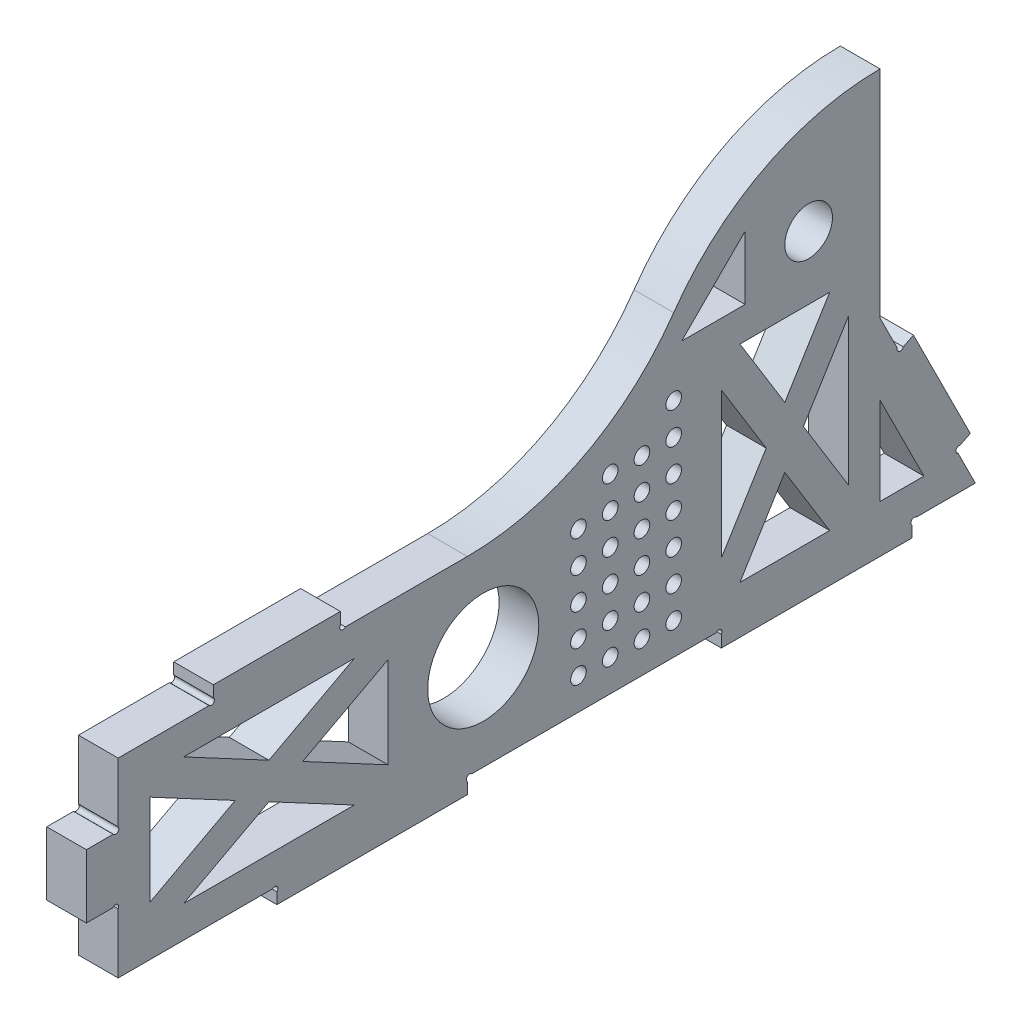
from build123d import *

# Parameters (mm, degrees)
BOSS_EXTRUDE1_DEPTH = 15.875
SKETCH2_R           = 9.525
CUT_EXTRUDE1_DEPTH  = 218.612378382
SKETCH3_W           = 76.2
SKETCH3_H           = 6.35
SKETCH3_W_2         = 12.7
SKETCH3_H_2         = 25.4
BOSS_EXTRUDE2_DEPTH = 15.875
SKETCH9_R           = 22.225
CUT_EXTRUDE4_DEPTH  = 218.612378382
CUT_EXTRUDE6_DEPTH  = 218.612378382
BOSS_EXTRUDE3_DEPTH = 15.875
SKETCH15_R          = 1.27
CUT_EXTRUDE8_DEPTH  = 218.612378382
SKETCH13_R          = 3.126994
CUT_EXTRUDE9_DEPTH  = 218.612378382
CUT_EXTRUDE10_DEPTH = 218.612378382


with BuildPart() as part:
    # Sketch1 → Boss-Extrude1 (new body)
    with BuildSketch(Plane(origin=(0, 0, 0), x_dir=(0, 0, -1), z_dir=(1, 0, 0))):
        with BuildLine():
            ThreePointArc((57.15, 81.28), (21.180615335, 49.546911859), (-25.4, 38.1))
            Line((-25.4, 38.1), (-76.2, 38.1))
            Line((-76.2, 38.1), (-76.2, 44.45))
            Line((-76.2, 44.45), (-127, 44.45))
            Line((-127, 44.45), (-127, 38.1))
            Line((-127, 38.1), (-165.1, 38.1))
            Line((-165.1, 38.1), (-165.1, -38.1))
            Line((-165.1, -38.1), (177.8, -38.1))
            Line((177.8, -38.1), (139.7, 38.1))
            Line((139.7, 38.1), (139.7, 124.46))
            ThreePointArc((139.7, 124.46), (93.119384665, 113.013088141), (57.15, 81.28))
        make_face()
    extrude(amount=BOSS_EXTRUDE1_DEPTH)

    # Sketch2 → Cut-Extrude1 (cut, through all)
    with BuildSketch(Plane(origin=(15.875, 0, 0), x_dir=(0, 0, -1), z_dir=(1, 0, 0))):
        with Locations((111.125, 82.55)):
            Circle(SKETCH2_R)
    extrude(amount=-CUT_EXTRUDE1_DEPTH, mode=Mode.SUBTRACT)

    # Sketch3 → Boss-Extrude2 (add)
    with BuildSketch(Plane(origin=(15.875, 0, 0), x_dir=(0, 0, -1), z_dir=(1, 0, 0))):
        with Locations((114.3, -41.275)):
            Rectangle(SKETCH3_W, SKETCH3_H)
        with Locations((-63.5, -41.275)):
            Rectangle(SKETCH3_W, SKETCH3_H)
        with Locations((-171.45, 0)):
            Rectangle(SKETCH3_W_2, SKETCH3_H_2)
    extrude(amount=-BOSS_EXTRUDE2_DEPTH)

    # Sketch9 → Cut-Extrude4 (cut, through all)
    with BuildSketch(Plane(origin=(15.875, 0, 0), x_dir=(0, 0, -1), z_dir=(1, 0, 0))):
        with Locations((-19.05, 0)):
            Circle(SKETCH9_R)
    extrude(amount=-CUT_EXTRUDE4_DEPTH, mode=Mode.SUBTRACT)

    # Sketch12 → Cut-Extrude6 (cut, through all)
    with BuildSketch(Plane(origin=(15.875, 0, 0), x_dir=(0, 0, -1), z_dir=(1, 0, 0))):
        Polygon((139.7, 9.701936686), (139.7, -25.4), (157.250968343, -25.4), align=None)
        Polygon((109.05604179, 15.875), (127, -13.283932092), (127, 45.033932092), align=None)
        Polygon((119.54395821, -25.4), (101.6, 3.758932092), (83.65604179, -25.4), align=None)
        Polygon((76.2, -13.283932092), (94.14395821, 15.875), (76.2, 45.033932092), align=None)
        Polygon((83.65604179, 57.15), (101.6, 27.991067908), (119.54395821, 57.15), align=None)
        Polygon((-57.15, -18.203333333), (-57.15, 18.203333333), (-91.28125, 0), align=None)
        Polygon((-70.64375, -25.4), (-104.775, -7.196666667), (-138.90625, -25.4), align=None)
        Polygon((-152.4, -18.203333333), (-118.26875, 0), (-152.4, 18.203333333), align=None)
        Polygon((-104.775, 7.196666667), (-70.64375, 25.4), (-138.90625, 25.4), align=None)
    extrude(amount=-CUT_EXTRUDE6_DEPTH, mode=Mode.SUBTRACT)

    # Sketch14 → Boss-Extrude3 (add)
    with BuildSketch(Plane(origin=(15.875, 0, 0), x_dir=(0, 0, -1), z_dir=(1, 0, 0))):
        Polygon((147.390774674, 22.718450651), (170.109225326, -22.718450651), (175.788837989, -19.87864432), (153.070387337, 25.558256983), align=None)
    extrude(amount=-BOSS_EXTRUDE3_DEPTH)

    # Sketch15 → Cut-Extrude8 (cut, through all)
    with BuildSketch(Plane(origin=(15.875, 0, 0), x_dir=(0, 0, -1), z_dir=(1, 0, 0))):
        with Locations((-166.14759319, -13.417947427)):
            Circle(SKETCH15_R)
        with Locations((-127.867535363, 39.027514093)):
            Circle(SKETCH15_R)
        with Locations((-102.468735692, -39.026389927)):
            Circle(SKETCH15_R)
        with Locations((75.20280066, -38.886443562)):
            Circle(SKETCH15_R)
        with Locations((153.276127819, -39.019402004)):
            Circle(SKETCH15_R)
        with Locations((-24.501616142, -38.997667224)):
            Circle(SKETCH15_R)
        with Locations((-166.09635678, 13.487510741)):
            Circle(SKETCH15_R)
        with Locations((-75.205348286, 38.8896632)):
            Circle(SKETCH15_R)
        with Locations((171.314053114, -23.120059914)):
            Circle(SKETCH15_R)
        with Locations((147.792383937, 23.92327844)):
            Circle(SKETCH15_R)
    extrude(amount=-CUT_EXTRUDE8_DEPTH, mode=Mode.SUBTRACT)

    # Sketch13 → Cut-Extrude9 (cut, through all)
    with BuildSketch(Plane(origin=(15.875, 0, 0), x_dir=(0, 0, -1), z_dir=(1, 0, 0))):
        with Locations((31.75, -25.4)):
            Circle(SKETCH13_R)
        with Locations((19.05, -25.4)):
            Circle(SKETCH13_R)
        with Locations((44.45, -25.4)):
            Circle(SKETCH13_R)
        with Locations((57.15, -25.4)):
            Circle(SKETCH13_R)
        with Locations((19.05, -12.7)):
            Circle(SKETCH13_R)
        with Locations((31.75, -12.7)):
            Circle(SKETCH13_R)
        with Locations((44.45, -12.7)):
            Circle(SKETCH13_R)
        with Locations((57.15, -12.7)):
            Circle(SKETCH13_R)
        with Locations((19.05, 0)):
            Circle(SKETCH13_R)
        with Locations((31.75, 0)):
            Circle(SKETCH13_R)
        with Locations((44.45, 0)):
            Circle(SKETCH13_R)
        with Locations((57.15, 0)):
            Circle(SKETCH13_R)
        with Locations((19.05, 12.7)):
            Circle(SKETCH13_R)
        with Locations((31.75, 12.7)):
            Circle(SKETCH13_R)
        with Locations((44.45, 12.7)):
            Circle(SKETCH13_R)
        with Locations((57.15, 12.7)):
            Circle(SKETCH13_R)
        with Locations((19.05, 25.4)):
            Circle(SKETCH13_R)
        with Locations((31.75, 25.4)):
            Circle(SKETCH13_R)
        with Locations((44.45, 25.4)):
            Circle(SKETCH13_R)
        with Locations((57.15, 25.4)):
            Circle(SKETCH13_R)
        with Locations((31.75, 38.1)):
            Circle(SKETCH13_R)
        with Locations((44.45, 38.1)):
            Circle(SKETCH13_R)
        with Locations((57.15, 38.1)):
            Circle(SKETCH13_R)
        with Locations((57.15, 50.8)):
            Circle(SKETCH13_R)
    extrude(amount=-CUT_EXTRUDE9_DEPTH, mode=Mode.SUBTRACT)

    # Sketch17 → Cut-Extrude10 (cut, through all)
    with BuildSketch(Plane(origin=(15.875, 0, 0), x_dir=(0, 0, -1), z_dir=(1, 0, 0))):
        Polygon((60.325, 69.85), (85.725, 69.85), (85.725, 95.25), align=None)
    extrude(amount=-CUT_EXTRUDE10_DEPTH, mode=Mode.SUBTRACT)


solid = part.part
